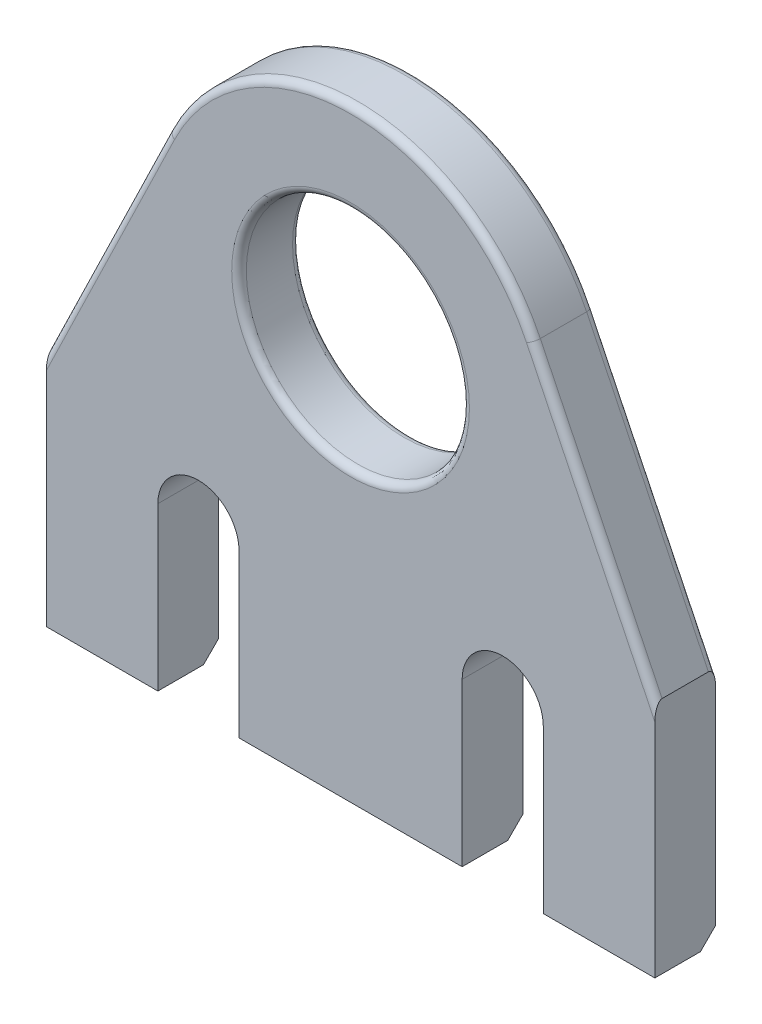
from build123d import *

# Parameters (mm, degrees)
SKETCH1_R      = 34.925
EXTRUDE1_DEPTH = 19.05
CHAMFER3_SIZE  = 4.7752
FILLET1_R      = 2.286


with BuildPart() as part:
    # Sketch1 → Extrude1 (new body)
    with BuildSketch(Plane.XY):
        with BuildLine():
            Line((-60.325, -74.6252), (-60.325, -125.4252))
            Line((-60.325, -125.4252), (-95.25, -125.4252))
            Line((-95.25, -125.4252), (-95.25, -50.8))
            Line((-95.25, -50.8), (-57.124032384, 27.732560721))
            ThreePointArc((-57.124032384, 27.732560721), (0, 63.5), (57.124032384, 27.732560721))
            Line((57.124032384, 27.732560721), (95.25, -50.8))
            Line((95.25, -50.8), (95.25, -125.4252))
            Line((95.25, -125.4252), (60.325, -125.4252))
            Line((60.325, -125.4252), (60.325, -74.6252))
            ThreePointArc((60.325, -74.6252), (47.625, -61.9252), (34.925, -74.6252))
            Line((34.925, -74.6252), (34.925, -125.4252))
            Line((34.925, -125.4252), (-34.925, -125.4252))
            Line((-34.925, -125.4252), (-34.925, -74.6252))
            ThreePointArc((-34.925, -74.6252), (-47.625, -61.9252), (-60.325, -74.6252))
        make_face()
        Circle(SKETCH1_R, mode=Mode.SUBTRACT)
    extrude(amount=-EXTRUDE1_DEPTH)

    # Chamfer3
    chamfer3_edges = [part.edges().sort_by_distance(p)[0] for p in [
        (0, -125.4252, -19.05),
        (77.7875, -125.4252, -19.05),
        (-77.7875, -125.4252, -19.05),
    ]]
    chamfer(chamfer3_edges, length=CHAMFER3_SIZE)

    # Fillet1
    fillet1_edges = [part.edges().sort_by_distance(p)[0] for p in [
        (-76.187016192, -11.53371964, 0),
        (0, 63.5, 0),
        (76.187016192, -11.53371964, 0),
        (76.187016192, -11.53371964, -19.05),
        (0, 63.5, -19.05),
        (-34.925, 0, -19.05),
        (-34.925, 0, 0),
        (-76.187016192, -11.53371964, -19.05),
    ]]
    fillet(fillet1_edges, radius=FILLET1_R)


solid = part.part
